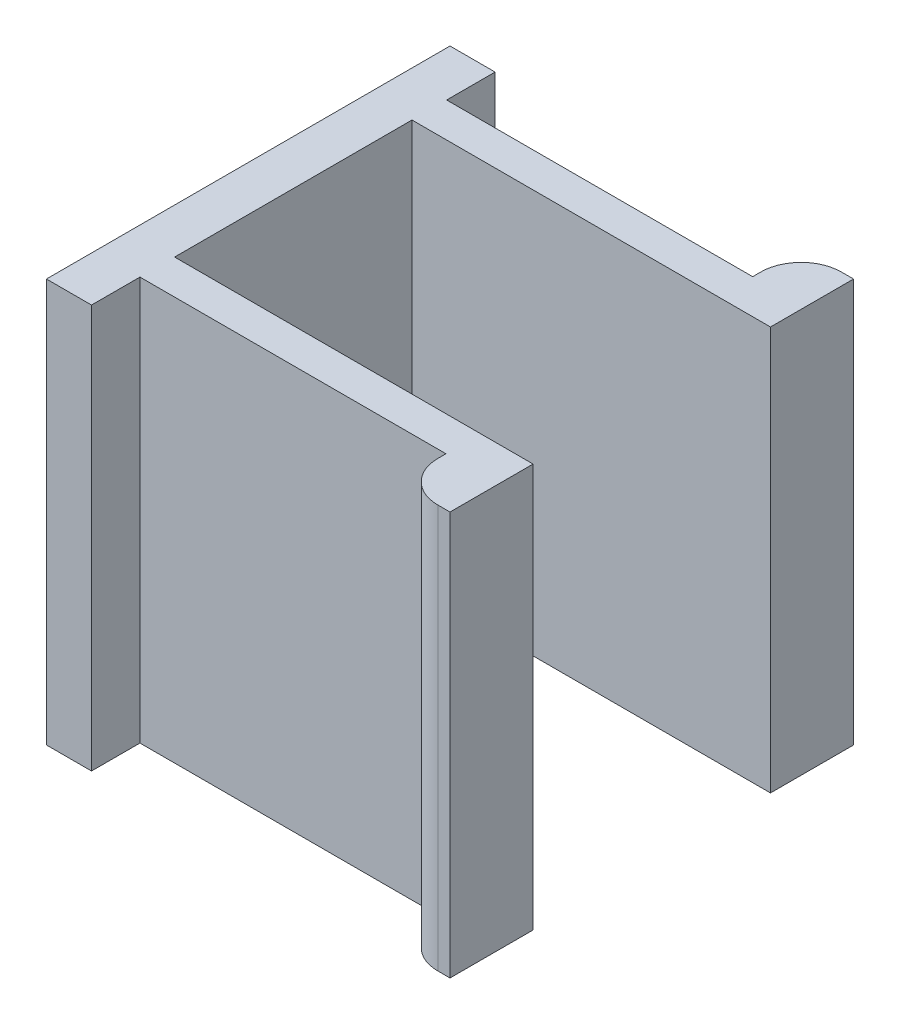
from build123d import *

# Parameters (mm, degrees)
SKETCH2_W           = 100
SKETCH2_H           = 100
BOSS_EXTRUDE2_DEPTH = 100
SKETCH4_W           = 88.827102195
SKETCH4_H           = 58.821478126
CUT_EXTRUDE1_DEPTH  = 100
SKETCH6_W           = 88.733960409
SKETCH6_H           = 88.503004296
BOSS_EXTRUDE3_DEPTH = 3


with BuildPart() as part:
    # Sketch2 → Boss-Extrude2 (new body)
    with BuildSketch(Plane.XY):
        with Locations((0, 50)):
            Rectangle(SKETCH2_W, SKETCH2_H)
    extrude(amount=BOSS_EXTRUDE2_DEPTH)

    # Sketch4 → Cut-Extrude1 (cut)
    with BuildSketch(Plane(origin=(0, 100, 0), x_dir=(1, 0, 0), z_dir=(0, 1, 0))):
        with Locations((5.586448902, -50)):
            Rectangle(SKETCH4_W, SKETCH4_H)
        with BuildLine():
            Line((-38.827102195, -88), (-38.827102195, -100))
            Line((-38.827102195, -100), (47, -100))
            ThreePointArc((47, -100), (39.928932188, -97.071067812), (37, -90))
            Line((37, -90), (37, -88))
            Line((37, -88), (-38.827102195, -88))
        make_face()
        with BuildLine():
            Line((47, 0), (-38.827102195, 0))
            Line((-38.827102195, 0), (-38.827102195, -12))
            Line((-38.827102195, -12), (37, -12))
            Line((37, -12), (37, -10))
            ThreePointArc((37, -10), (39.928932188, -2.928932188), (47, 0))
        make_face()
    extrude(amount=-CUT_EXTRUDE1_DEPTH, mode=Mode.SUBTRACT)

    # Sketch6 → Boss-Extrude3 (add)
    with BuildSketch(Plane.ZY.offset(50)):
        with Locations((49.115734201, 50.114251056)):
            Rectangle(SKETCH6_W, SKETCH6_H)
    extrude(amount=BOSS_EXTRUDE3_DEPTH)


solid = part.part
